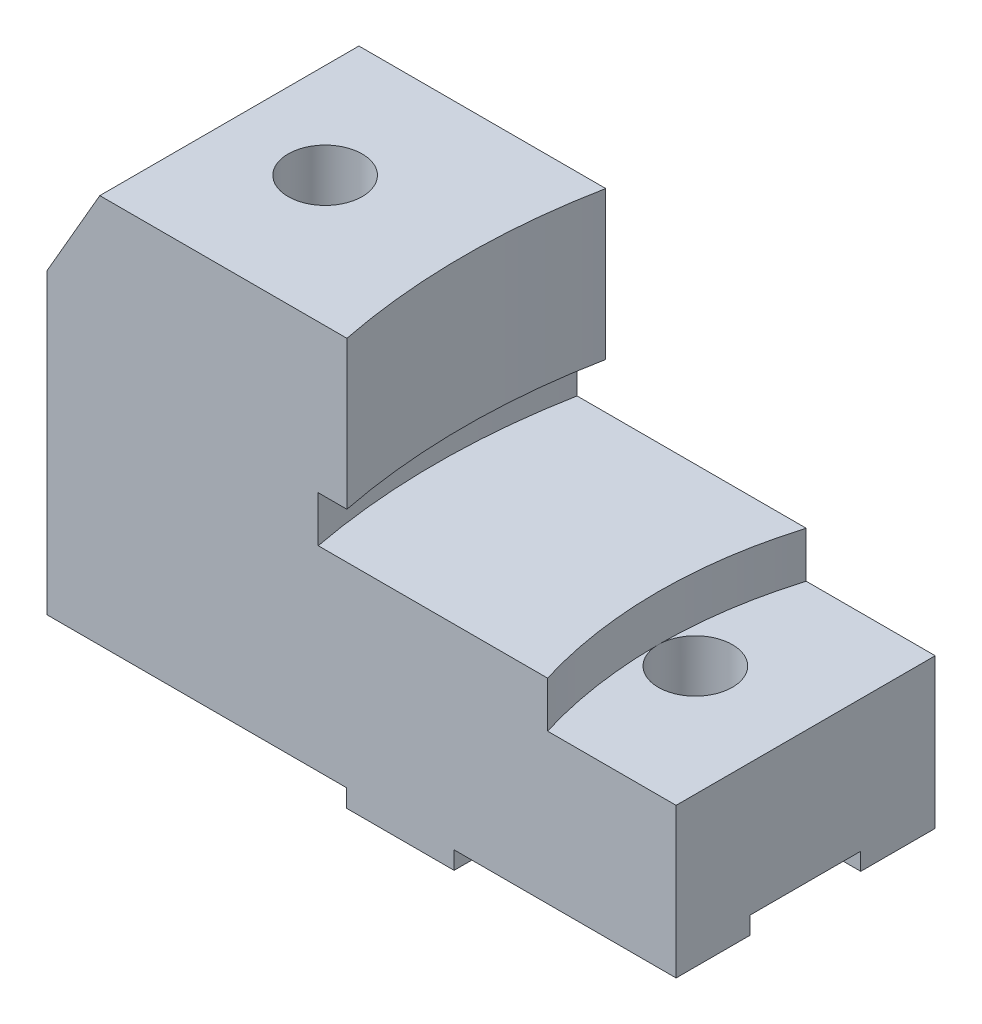
from build123d import *

# Parameters (mm, degrees)
SKETCH1_W           = 107.95
SKETCH1_H           = 44.45
BOSS_EXTRUDE1_DEPTH = 69.85
SKETCH2_W           = 18.973953495
SKETCH2_H           = 6.048241647
CUT_EXTRUDE1_DEPTH  = 141.986
SKETCH3_W           = 38.080163228
SKETCH3_H           = 3.050825249
SKETCH3_W_2         = 51.430009823
CUT_EXTRUDE3_DEPTH  = 141.986
CUT_EXTRUDE4_DEPTH  = 141.986
SKETCH8_R           = 114.3
CUT_EXTRUDE6_DEPTH  = 33.274
SKETCH12_R          = 119.126
CUT_EXTRUDE7_DEPTH  = 7.874
SKETCH13_R          = 6.35
CUT_EXTRUDE8_DEPTH  = 20.574
SKETCH14_R          = 76.2
CUT_EXTRUDE9_DEPTH  = 7.874
SKETCH15_R          = 6.35
CUT_EXTRUDE10_DEPTH = 20.574
SKETCH16_R          = 4.826
CUT_EXTRUDE11_DEPTH = 81.28


with BuildPart() as part:
    # Sketch1 → Boss-Extrude1 (new body)
    with BuildSketch(Plane(origin=(0, 0, 0), x_dir=(1, 0, 0), z_dir=(0, 1, 0))):
        with Locations((2.544990177, 0.698624754)):
            Rectangle(SKETCH1_W, SKETCH1_H)
    extrude(amount=BOSS_EXTRUDE1_DEPTH)

    # Sketch2 → Cut-Extrude1 (cut)
    with BuildSketch(Plane(origin=(56.519990177, 0, 0), x_dir=(0, 0, -1), z_dir=(1, 0, 0))):
        with Locations((0.660601501, 3.024120824)):
            Rectangle(SKETCH2_W, SKETCH2_H)
    extrude(amount=-CUT_EXTRUDE1_DEPTH, mode=Mode.SUBTRACT)

    # Sketch3 → Cut-Extrude3 (cut)
    with BuildSketch(Plane.XY.offset(21.526375246)):
        with Locations((37.479908563, 1.525412625)):
            Rectangle(SKETCH3_W, SKETCH3_H)
        with Locations((-25.715004912, 1.525412625)):
            Rectangle(SKETCH3_W_2, SKETCH3_H)
    extrude(amount=-CUT_EXTRUDE3_DEPTH, mode=Mode.SUBTRACT)

    # Sketch7 → Cut-Extrude4 (cut)
    with BuildSketch(Plane.XY.offset(21.526375246)):
        Polygon((-51.430009823, 54.102), (-42.337897784, 69.85), (-51.430009823, 69.85), align=None)
    extrude(amount=-CUT_EXTRUDE4_DEPTH, mode=Mode.SUBTRACT)

    # Sketch8 → Cut-Extrude6 (cut)
    with BuildSketch(Plane(origin=(0, 69.85, 0), x_dir=(1, 0, 0), z_dir=(0, 1, 0))):
        with Locations((112.145990177, 0.825624754)):
            Circle(SKETCH8_R)
    extrude(amount=-CUT_EXTRUDE6_DEPTH, mode=Mode.SUBTRACT)

    # Sketch12 → Cut-Extrude7 (cut)
    with BuildSketch(Plane(origin=(0, 36.576, 0), x_dir=(1, 0, 0), z_dir=(0, 1, 0))):
        with Locations((112.145990177, 0.825624754)):
            Circle(SKETCH12_R)
    extrude(amount=CUT_EXTRUDE7_DEPTH, mode=Mode.SUBTRACT)

    # Sketch13 → Cut-Extrude8 (cut)
    with BuildSketch(Plane(origin=(0, 36.576, 0), x_dir=(1, 0, 0), z_dir=(0, 1, 0))):
        with Locations(Location((37.469990177, 0.825624754, 0), (0, 0, 270))):
            Circle(SKETCH13_R)
    extrude(amount=-CUT_EXTRUDE8_DEPTH, mode=Mode.SUBTRACT)

    # Sketch14 → Cut-Extrude9 (cut)
    with BuildSketch(Plane(origin=(0, 36.576, 0), x_dir=(1, 0, 0), z_dir=(0, 1, 0))):
        with Locations((107.319990177, 0.825624754)):
            Circle(SKETCH14_R)
    extrude(amount=-CUT_EXTRUDE9_DEPTH, mode=Mode.SUBTRACT)

    # Sketch15 → Cut-Extrude10 (cut)
    with BuildSketch(Plane(origin=(0, 69.85, 0), x_dir=(1, 0, 0), z_dir=(0, 1, 0))):
        with Locations(Location((-26.030009823, 0.825624754, 0), (0, 0, 270))):
            Circle(SKETCH15_R)
    extrude(amount=-CUT_EXTRUDE10_DEPTH, mode=Mode.SUBTRACT)

    # Sketch16 → Cut-Extrude11 (cut)
    with BuildSketch(Plane(origin=(0, 69.85, 0), x_dir=(1, 0, 0), z_dir=(0, 1, 0))):
        with Locations(Location((-26.030009823, 0.825624754, 0), (0, 0, 270))):
            Circle(SKETCH16_R)
        with Locations(Location((37.469990177, 0.825624754, 0), (0, 0, 270))):
            Circle(SKETCH16_R)
    extrude(amount=-CUT_EXTRUDE11_DEPTH, mode=Mode.SUBTRACT)


solid = part.part
